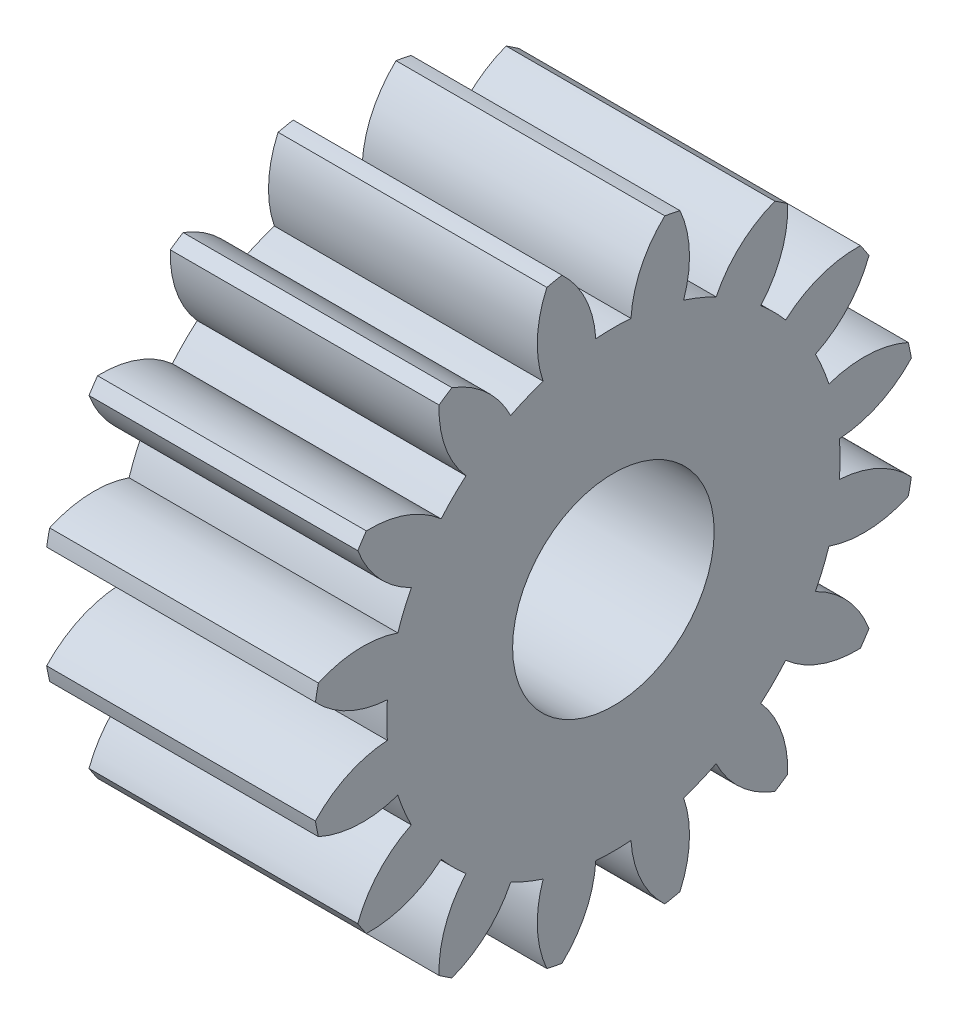
from build123d import *

# Parameters (mm, degrees)
BASPROSKE_W     = 4
BASPROSKE_H     = 4.5
TOOTHCUT_DEPTH  = 8.516648189
TEETHCUTS_COUNT = 16
TEETHCUTS_ANGLE = 337.5
BORSKE_R        = 1.5
BORE_DEPTH      = 50.0000508


with BuildPart() as part:
    # BasProSke → Base-Revolve (revolve)
    with BuildSketch(Plane(origin=(0, 0, 0), x_dir=(1, 0, 0), z_dir=(0, 1, 0)), mode=Mode.PRIVATE) as base_revolve_sk:
        with Locations((2, 2.25)):
            Rectangle(BASPROSKE_W, BASPROSKE_H)
    revolve(base_revolve_sk.sketch.rotate(Axis((-10, 0, 0), (1, 0, 0)), 180), axis=Axis((-10, 0, 0), (1, 0, 0)))

    # TooCutSke → ToothCut (cut, through all)
    with BuildSketch(Plane(origin=(0, 0, 0), x_dir=(0, 0, -1), z_dir=(1, 0, 0))):
        with BuildLine():
            ThreePointArc((0.261866103, 3.363822549), (0, 3.374), (-0.261866103, 3.363822549))
            ThreePointArc((-0.261866103, 3.363822549), (-0.417714668, 3.961827375), (-0.788562282, 4.456165918))
            ThreePointArc((-0.788562282, 4.456165918), (0, 4.5254), (0.788562282, 4.456165918))
            ThreePointArc((0.788562282, 4.456165918), (0.417714668, 3.961827375), (0.261866103, 3.363822549))
        make_face()
    toothcut = extrude(amount=TOOTHCUT_DEPTH, mode=Mode.SUBTRACT)

    # TeethCuts: ToothCut ×16 about axis
    teethcuts_axis = Axis((-10, 0, 0), (1, 0, 0))
    for i in range(1, TEETHCUTS_COUNT):
        add(toothcut.rotate(teethcuts_axis, i * TEETHCUTS_ANGLE / (TEETHCUTS_COUNT - 1)), mode=Mode.SUBTRACT)

    # BorSke → Bore (cut, symmetric)
    with BuildSketch(Plane(origin=(0, 0, 0), x_dir=(0, 0, -1), z_dir=(1, 0, 0))):
        with Locations(Location((0, 0, 0), (0, 0, 180))):
            Circle(BORSKE_R)
    extrude(amount=BORE_DEPTH, both=True, mode=Mode.SUBTRACT)


solid = part.part
